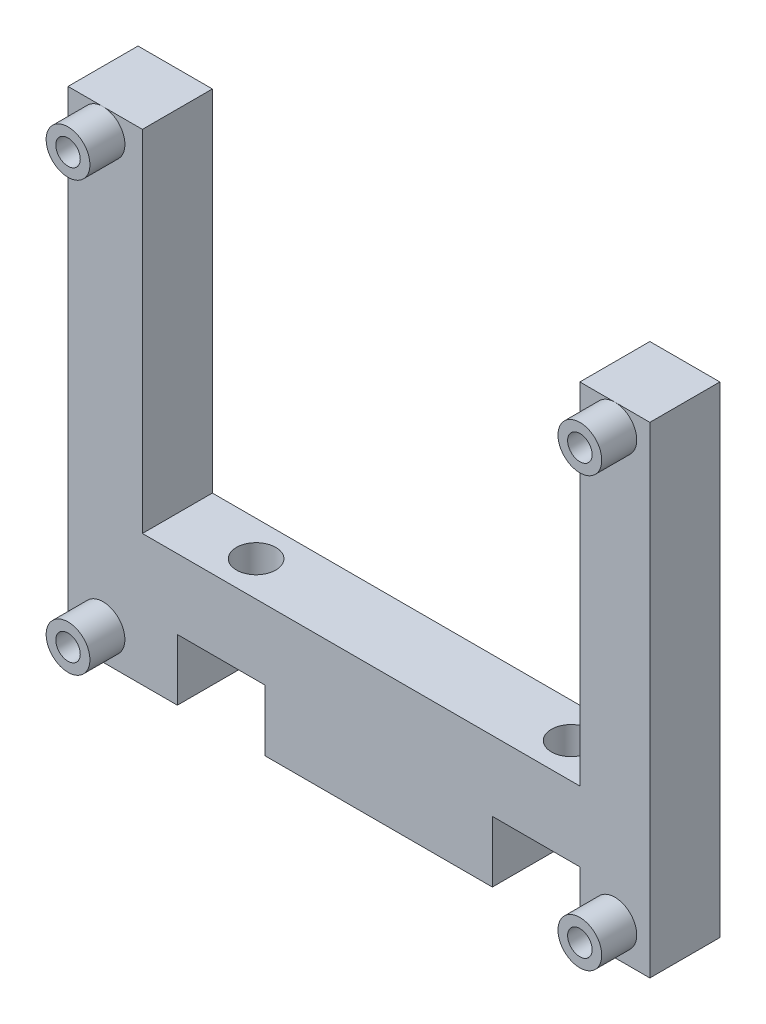
from build123d import *

# Parameters (mm, degrees)
SCHIZZO1_R                     = 2.5
SCHIZZO1_R_2                   = 1.4
ESTRUSIONE_ESTRUSIONE1_DEPTH   = 4
ESTRUSIONE_ESTRUSIONE1_2_DEPTH = 4
ESTRUSIONE_ESTRUSIONE1_3_DEPTH = 4
ESTRUSIONE_ESTRUSIONE1_4_DEPTH = 4
ESTRUSIONE_ESTRUSIONE2_DEPTH   = 8
SCHIZZO3_R                     = 2.25
TAGLIO_ESTRUSIONE1_DEPTH       = 18
SCHIZZO4_W                     = 10
SCHIZZO4_H                     = 8
TAGLIO_ESTRUSIONE2_DEPTH       = 7


with BuildPart() as part:
    # Schizzo1 → Estrusione-Estrusione1 (new body)
    with BuildSketch(Plane.XY):
        with Locations((-29.25, 24.5)):
            Circle(SCHIZZO1_R)
        with Locations((-29.25, 24.5)):
            Circle(SCHIZZO1_R_2, mode=Mode.SUBTRACT)
    extrude(amount=ESTRUSIONE_ESTRUSIONE1_DEPTH)



with BuildPart() as body_2:
    # Schizzo1 → Estrusione-Estrusione1 2 (new body)
    with BuildSketch(Plane.XY):
        with Locations((29.25, 24.5)):
            Circle(SCHIZZO1_R)
        with Locations((29.25, 24.5)):
            Circle(SCHIZZO1_R_2, mode=Mode.SUBTRACT)
    extrude(amount=ESTRUSIONE_ESTRUSIONE1_2_DEPTH)


with BuildPart() as body_3:
    # Schizzo1 → Estrusione-Estrusione1 3 (new body)
    with BuildSketch(Plane.XY):
        with Locations((29.25, -24.5)):
            Circle(SCHIZZO1_R)
        with Locations((29.25, -24.5)):
            Circle(SCHIZZO1_R_2, mode=Mode.SUBTRACT)
    extrude(amount=ESTRUSIONE_ESTRUSIONE1_3_DEPTH)


with BuildPart() as body_4:
    # Schizzo1 → Estrusione-Estrusione1 4 (new body)
    with BuildSketch(Plane.XY):
        with Locations((-29.25, -24.5)):
            Circle(SCHIZZO1_R)
        with Locations((-29.25, -24.5)):
            Circle(SCHIZZO1_R_2, mode=Mode.SUBTRACT)
    extrude(amount=ESTRUSIONE_ESTRUSIONE1_4_DEPTH)


with BuildPart() as part_1:
    add(part.part)

    add(body_2.part)  # Estrusione-Estrusione2 merges body 2

    add(body_3.part)  # Estrusione-Estrusione2 merges body 3

    add(body_4.part)  # Estrusione-Estrusione2 merges body 4
    # Schizzo2 → Estrusione-Estrusione2 (add)
    with BuildSketch(Plane.XY):
        Polygon((33.25, 27), (33.25, -28), (-33.25, -28), (-33.25, 27), (-24.75, 27), (-24.75, -13), (25.25, -13), (25.25, 27), align=None)
    extrude(amount=-ESTRUSIONE_ESTRUSIONE2_DEPTH)

    # Schizzo3 → Taglio-Estrusione1 (cut)
    with BuildSketch(Plane.XZ.offset(28)):
        with Locations((-15.75, -4)):
            Circle(SCHIZZO3_R)
        with Locations((20.25, -4)):
            Circle(SCHIZZO3_R)
    extrude(amount=-TAGLIO_ESTRUSIONE1_DEPTH, mode=Mode.SUBTRACT)

    # Schizzo4 → Taglio-Estrusione2 (cut)
    with BuildSketch(Plane.XZ.offset(28)):
        with Locations((-15.75, -4)):
            Rectangle(SCHIZZO4_W, SCHIZZO4_H)
        with Locations((20.25, -4)):
            Rectangle(SCHIZZO4_W, SCHIZZO4_H)
    extrude(amount=-TAGLIO_ESTRUSIONE2_DEPTH, mode=Mode.SUBTRACT)


solid = part_1.part
